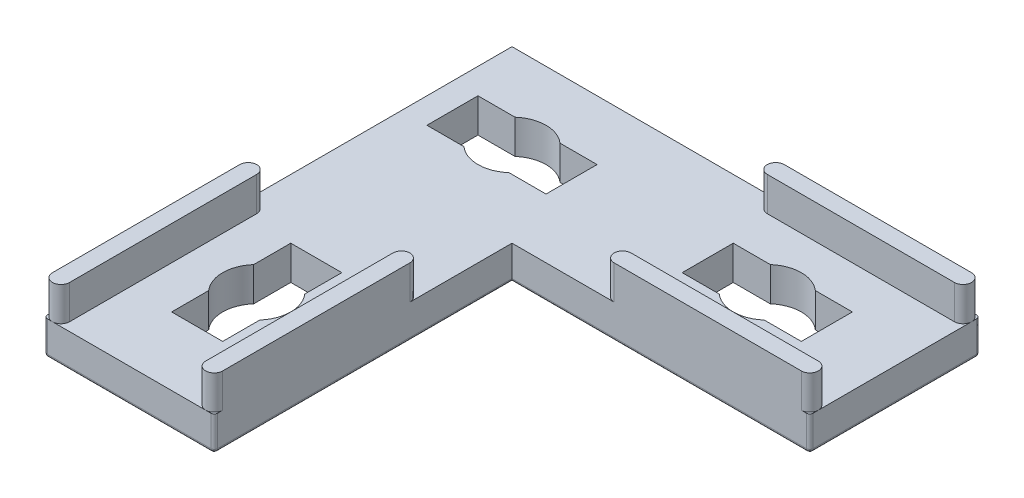
from build123d import *

# Parameters (mm, degrees)
EXTRUDE_1_DEPTH        = 2
EXTRUDE_2_DEPTH        = 2
CUT_EXTRUDE_1_REACH    = 40.942
PATTERN_LINEAR_1_COUNT = 2
PATTERN_LINEAR_1_PITCH = 15
CUT_EXTRUDE_2_REACH    = 40.942
FILLET_1_R             = 0.2


with BuildPart() as part:
    # 草图1 → 凸台-拉伸1 (new body)
    with BuildSketch(Plane(origin=(0, 0, 0), x_dir=(1, 0, 0), z_dir=(0, 1, 0))):
        Polygon((0, 0), (0, -27.5), (10, -27.5), (10, -10), (27.5, -10), (27.5, 0), align=None)
    extrude(amount=EXTRUDE_1_DEPTH)

    # 草图2 → 凸台-拉伸2 (add)
    with BuildSketch(Plane(origin=(0, 2, 0), x_dir=(1, 0, 0), z_dir=(0, 1, 0))):
        with BuildLine():
            Line((27, 0), (16, 0))
            ThreePointArc((16, 0), (15.5, -0.5), (16, -1))
            Line((16, -1), (27, -1))
            ThreePointArc((27, -1), (27.5, -0.5), (27, 0))
        make_face()
        with BuildLine():
            Line((27, -9), (16, -9))
            ThreePointArc((16, -9), (15.5, -9.5), (16, -10))
            Line((16, -10), (27, -10))
            ThreePointArc((27, -10), (27.5, -9.5), (27, -9))
        make_face()
        with BuildLine():
            Line((1, -27), (1, -16))
            ThreePointArc((1, -16), (0.5, -15.5), (0, -16))
            Line((0, -16), (0, -27))
            ThreePointArc((0, -27), (0.5, -27.5), (1, -27))
        make_face()
        with BuildLine():
            Line((9, -27), (9, -16))
            ThreePointArc((9, -16), (9.5, -15.5), (10, -16))
            Line((10, -16), (10, -27))
            ThreePointArc((10, -27), (9.5, -27.5), (9, -27))
        make_face()
    extrude(amount=EXTRUDE_2_DEPTH)

    # 草图3 → 切除-拉伸1 (cut, up to next)
    with BuildSketch(Plane(origin=(0, 2, 0), x_dir=(1, 0, 0), z_dir=(0, 1, 0)), mode=Mode.PRIVATE) as cut_extrude_1_sk1:
        with BuildLine():
            Line((23.5, -3.5), (23.5, -6.5))
            Line((23.5, -6.5), (21.322875656, -6.5))
            ThreePointArc((21.322875656, -6.5), (20, -7), (18.677124344, -6.5))
            Line((18.677124344, -6.5), (16.5, -6.5))
            Line((16.5, -6.5), (16.5, -3.5))
            Line((16.5, -3.5), (18.677124344, -3.5))
            ThreePointArc((18.677124344, -3.5), (20, -3), (21.322875656, -3.5))
            Line((21.322875656, -3.5), (23.5, -3.5))
        make_face()
    cut_extrude_1_tool1 = extrude(cut_extrude_1_sk1.sketch, amount=-CUT_EXTRUDE_1_REACH, mode=Mode.PRIVATE) & part.part
    cut_extrude_1 = cut_extrude_1_tool1.solids().sort_by_distance((20, 2, 5))[0]
    add(cut_extrude_1, mode=Mode.SUBTRACT)

    # 阵列(线性)1: 切除-拉伸1 ×2
    with Locations(*[(-i * PATTERN_LINEAR_1_PITCH, 0, 0) for i in range(1, PATTERN_LINEAR_1_COUNT)]):
        add(cut_extrude_1, mode=Mode.SUBTRACT)

    # 草图4 → 切除-拉伸2 (cut, up to next)
    with BuildSketch(Plane(origin=(0, 2, 0), x_dir=(1, 0, 0), z_dir=(0, 1, 0)), mode=Mode.PRIVATE) as cut_extrude_2_sk1:
        with BuildLine():
            Line((6.5, -23.5), (3.5, -23.5))
            Line((3.5, -23.5), (3.5, -21.322875656))
            ThreePointArc((3.5, -21.322875656), (3, -20), (3.5, -18.677124344))
            Line((3.5, -18.677124344), (3.5, -16.5))
            Line((3.5, -16.5), (6.5, -16.5))
            Line((6.5, -16.5), (6.5, -18.677124344))
            ThreePointArc((6.5, -18.677124344), (7, -20), (6.5, -21.322875656))
            Line((6.5, -21.322875656), (6.5, -23.5))
        make_face()
    cut_extrude_2_tool1 = extrude(cut_extrude_2_sk1.sketch, amount=-CUT_EXTRUDE_2_REACH, mode=Mode.PRIVATE) & part.part
    add(cut_extrude_2_tool1.solids().sort_by_distance((5, 2, 20))[0], mode=Mode.SUBTRACT)

    # 圆角1
    fillet_1_edges = [part.edges().sort_by_distance(p)[0] for p in [
        (27.5, 1, 0),
        (27.5, 1, 10),
        (0, 1, 27.5),
        (10, 1, 27.5),
        (5, 0, 27.5),
        (27.5, 0, 5),
        (10, 0, 18.75),
        (18.75, 0, 10),
        (0, 0, 13.75),
        (13.75, 0, 0),
    ]]
    fillet(fillet_1_edges, radius=FILLET_1_R)


solid = part.part
